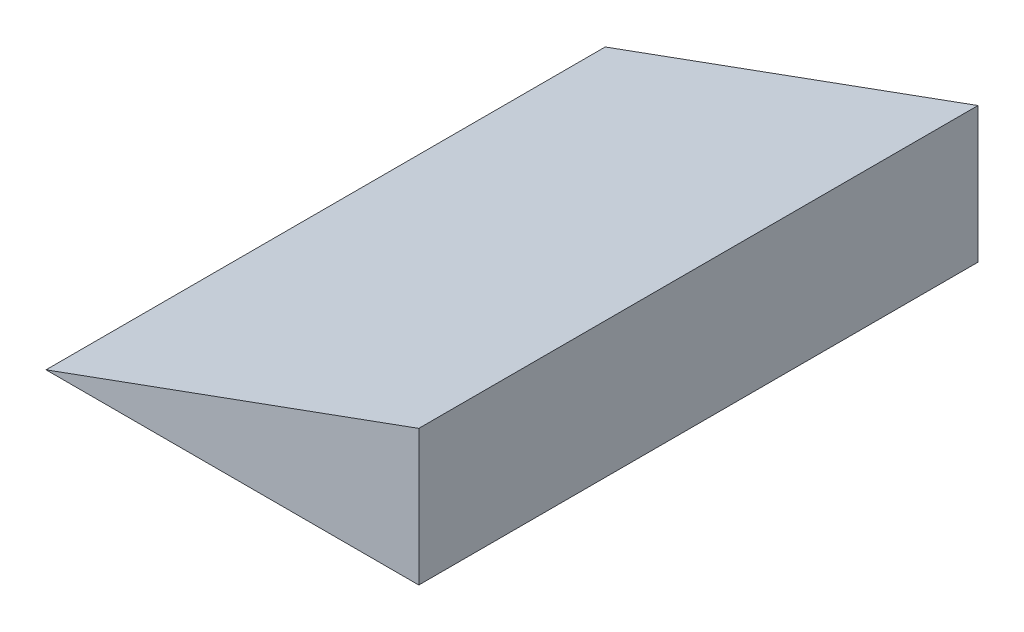
from build123d import *

# Parameters (mm, degrees)
BOSS_EXTRUDE1_DEPTH = 6000


with BuildPart() as part:
    # Sketch1 → Boss-Extrude1 (new body)
    with BuildSketch(Plane.XY):
        Polygon((-2000, 0), (2000, 0), (2000, 1455.880937065), align=None)
    extrude(amount=BOSS_EXTRUDE1_DEPTH)


solid = part.part
